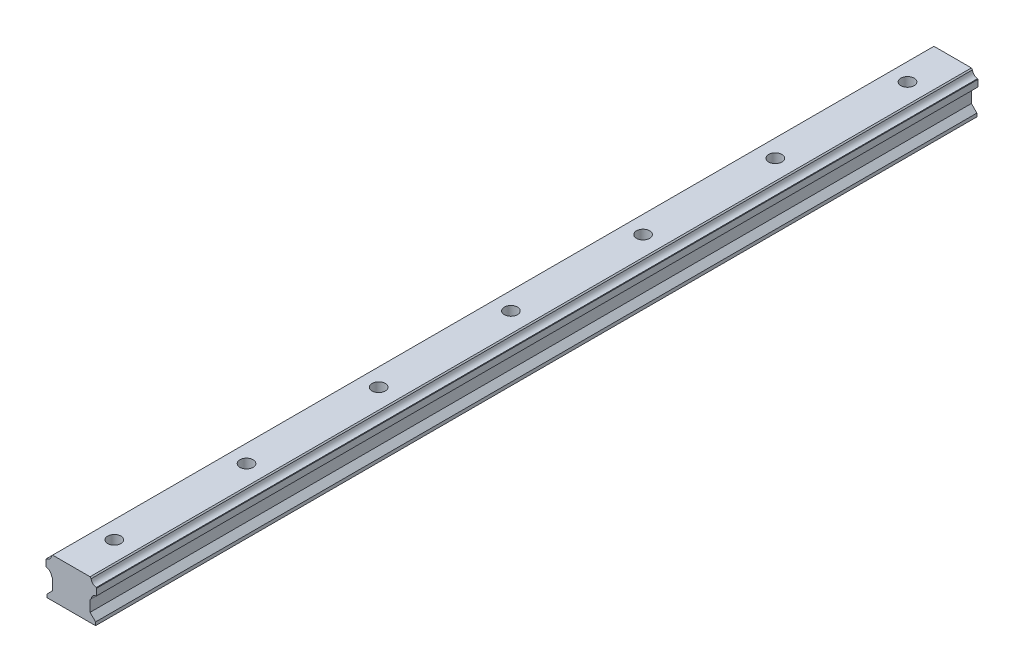
from build123d import *

# Parameters (mm, degrees)
ESTRUSIONE_ESTRUSIONE1_DEPTH      = 400
SCHIZZO2_R                        = 3
TAGLIO_ESTRUSIONE1_DEPTH          = 401.599824902
RIPETIZIONE_A_L1_COUNT            = 4
RIPETIZIONE_A_L1_PITCH            = 60
RIPETIZIONE_A_L2_COPY_1_SKETCH_R  = 3
RIPETIZIONE_A_L2_COPY_1_DEPTH     = 401.599824902
RIPETIZIONE_A_L2_COPY_2_SKETCH_R  = 3
RIPETIZIONE_A_L2_COPY_2_DEPTH     = 401.599824902
RIPETIZIONE_A_L2_COPY_3_SKETCH_R  = 3
RIPETIZIONE_A_L2_COPY_3_DEPTH     = 401.599824902
RIPETIZIONE_A_L2_COPY_4_SKETCH_R  = 3
RIPETIZIONE_A_L2_COPY_4_DEPTH     = 401.599824902
RIPETIZIONE_A_L2_COPY_5_SKETCH_R  = 3
RIPETIZIONE_A_L2_COPY_5_DEPTH     = 401.599824902
RIPETIZIONE_A_L2_COPY_6_SKETCH_R  = 3
RIPETIZIONE_A_L2_COPY_6_DEPTH     = 401.599824902
RIPETIZIONE_A_L2_COPY_7_SKETCH_R  = 3
RIPETIZIONE_A_L2_COPY_7_DEPTH     = 401.599824902
RIPETIZIONE_A_L2_COPY_8_SKETCH_R  = 3
RIPETIZIONE_A_L2_COPY_8_DEPTH     = 401.599824902
RIPETIZIONE_A_L2_COPY_9_SKETCH_R  = 3
RIPETIZIONE_A_L2_COPY_9_DEPTH     = 401.599824902
RIPETIZIONE_A_L2_COPY_10_SKETCH_R = 3
RIPETIZIONE_A_L2_COPY_10_DEPTH    = 401.599824902
RIPETIZIONE_A_L2_COPY_11_SKETCH_R = 3
RIPETIZIONE_A_L2_COPY_11_DEPTH    = 401.599824902
RIPETIZIONE_A_L2_COPY_12_SKETCH_R = 3
RIPETIZIONE_A_L2_COPY_12_DEPTH    = 401.599824902


with BuildPart() as part:
    # Schizzo1 → Estrusione-Estrusione1 (new body)
    with BuildSketch(Plane.XY):
        with BuildLine():
            Line((-10.001211602, -16.276222172), (-7.501211602, -13.776222172))
            Line((-7.501211602, -13.776222172), (-7.501211602, -8.776222172))
            Line((-7.501211602, -8.776222172), (-8.008796188, -8.268637585))
            ThreePointArc((-8.008796188, -8.268637585), (-8.733444649, -6.695460987), (-10.306621247, -5.970812526))
            Line((-10.306621247, -5.970812526), (-10.501211602, -5.776222172))
            Line((-10.501211602, -5.776222172), (-10.501211602, -2.776222172))
            Line((-10.501211602, -2.776222172), (-10.306621247, -2.581631817))
            ThreePointArc((-10.306621247, -2.581631817), (-8.733444649, -1.856983356), (-8.008796188, -0.283806758))
            Line((-8.008796188, -0.283806758), (-7.501211602, 0.223777828))
            Line((-7.501211602, 0.223777828), (9.498788398, 0.223777828))
            Line((9.498788398, 0.223777828), (10.006372984, -0.283806758))
            ThreePointArc((10.006372984, -0.283806758), (10.731021445, -1.856983356), (12.304198043, -2.581631817))
            Line((12.304198043, -2.581631817), (12.498788398, -2.776222172))
            Line((12.498788398, -2.776222172), (12.498788398, -5.776222172))
            Line((12.498788398, -5.776222172), (12.304198043, -5.970812526))
            ThreePointArc((12.304198043, -5.970812526), (10.731021445, -6.695460987), (10.006372984, -8.268637585))
            Line((10.006372984, -8.268637585), (9.498788398, -8.776222172))
            Line((9.498788398, -8.776222172), (9.498788398, -13.776222172))
            Line((9.498788398, -13.776222172), (11.998788398, -16.276222172))
            Line((11.998788398, -16.276222172), (11.998788398, -17.776222172))
            Line((11.998788398, -17.776222172), (-10.001211602, -17.776222172))
            Line((-10.001211602, -17.776222172), (-10.001211602, -16.276222172))
        make_face()
    extrude(amount=ESTRUSIONE_ESTRUSIONE1_DEPTH)

    # Schizzo2 → Taglio-Estrusione1 (cut, through all)
    with BuildSketch(Plane(origin=(0, 0.223777828, 0), x_dir=(1, 0, 0), z_dir=(0, 1, 0))):
        with Locations(Location((0.499394199, -200, 0), (0, 0, 270))):
            Circle(SCHIZZO2_R)
    taglio_estrusione1 = extrude(amount=-TAGLIO_ESTRUSIONE1_DEPTH, mode=Mode.SUBTRACT)

    # Ripetizione a L1: Taglio-Estrusione1 ×4
    with Locations(*[(0, 0, i * RIPETIZIONE_A_L1_PITCH) for i in range(1, RIPETIZIONE_A_L1_COUNT)]):
        add(taglio_estrusione1, mode=Mode.SUBTRACT)

    # Ripetizione a L2 copy 1 sketch → Ripetizione a L2 copy 1 (cut, through all)
    with BuildSketch(Plane(origin=(0, 0.223777828, 0), x_dir=(1, 0, 0), z_dir=(0, 1, 0))):
        with Locations(Location((0.499394199, -200, 0), (0, 0, 270))):
            Circle(RIPETIZIONE_A_L2_COPY_1_SKETCH_R)
    extrude(amount=-RIPETIZIONE_A_L2_COPY_1_DEPTH, mode=Mode.SUBTRACT)

    # Ripetizione a L2 copy 2 sketch → Ripetizione a L2 copy 2 (cut, through all)
    with BuildSketch(Plane(origin=(0, 0.223777828, -60), x_dir=(1, 0, 0), z_dir=(0, 1, 0))):
        with Locations(Location((0.499394199, -200, 0), (0, 0, 270))):
            Circle(RIPETIZIONE_A_L2_COPY_2_SKETCH_R)
    extrude(amount=-RIPETIZIONE_A_L2_COPY_2_DEPTH, mode=Mode.SUBTRACT)

    # Ripetizione a L2 copy 3 sketch → Ripetizione a L2 copy 3 (cut, through all)
    with BuildSketch(Plane(origin=(0, 0.223777828, -120), x_dir=(1, 0, 0), z_dir=(0, 1, 0))):
        with Locations(Location((0.499394199, -200, 0), (0, 0, 270))):
            Circle(RIPETIZIONE_A_L2_COPY_3_SKETCH_R)
    extrude(amount=-RIPETIZIONE_A_L2_COPY_3_DEPTH, mode=Mode.SUBTRACT)

    # Ripetizione a L2 copy 4 sketch → Ripetizione a L2 copy 4 (cut, through all)
    with BuildSketch(Plane(origin=(0, 0.223777828, 60), x_dir=(1, 0, 0), z_dir=(0, 1, 0))):
        with Locations(Location((0.499394199, -200, 0), (0, 0, 270))):
            Circle(RIPETIZIONE_A_L2_COPY_4_SKETCH_R)
    extrude(amount=-RIPETIZIONE_A_L2_COPY_4_DEPTH, mode=Mode.SUBTRACT)

    # Ripetizione a L2 copy 5 sketch → Ripetizione a L2 copy 5 (cut, through all)
    with BuildSketch(Plane(origin=(0, 0.223777828, 0), x_dir=(1, 0, 0), z_dir=(0, 1, 0))):
        with Locations(Location((0.499394199, -200, 0), (0, 0, 270))):
            Circle(RIPETIZIONE_A_L2_COPY_5_SKETCH_R)
    extrude(amount=-RIPETIZIONE_A_L2_COPY_5_DEPTH, mode=Mode.SUBTRACT)

    # Ripetizione a L2 copy 6 sketch → Ripetizione a L2 copy 6 (cut, through all)
    with BuildSketch(Plane(origin=(0, 0.223777828, -60), x_dir=(1, 0, 0), z_dir=(0, 1, 0))):
        with Locations(Location((0.499394199, -200, 0), (0, 0, 270))):
            Circle(RIPETIZIONE_A_L2_COPY_6_SKETCH_R)
    extrude(amount=-RIPETIZIONE_A_L2_COPY_6_DEPTH, mode=Mode.SUBTRACT)

    # Ripetizione a L2 copy 7 sketch → Ripetizione a L2 copy 7 (cut, through all)
    with BuildSketch(Plane(origin=(0, 0.223777828, 120), x_dir=(1, 0, 0), z_dir=(0, 1, 0))):
        with Locations(Location((0.499394199, -200, 0), (0, 0, 270))):
            Circle(RIPETIZIONE_A_L2_COPY_7_SKETCH_R)
    extrude(amount=-RIPETIZIONE_A_L2_COPY_7_DEPTH, mode=Mode.SUBTRACT)

    # Ripetizione a L2 copy 8 sketch → Ripetizione a L2 copy 8 (cut, through all)
    with BuildSketch(Plane(origin=(0, 0.223777828, 60), x_dir=(1, 0, 0), z_dir=(0, 1, 0))):
        with Locations(Location((0.499394199, -200, 0), (0, 0, 270))):
            Circle(RIPETIZIONE_A_L2_COPY_8_SKETCH_R)
    extrude(amount=-RIPETIZIONE_A_L2_COPY_8_DEPTH, mode=Mode.SUBTRACT)

    # Ripetizione a L2 copy 9 sketch → Ripetizione a L2 copy 9 (cut, through all)
    with BuildSketch(Plane(origin=(0, 0.223777828, 0), x_dir=(1, 0, 0), z_dir=(0, 1, 0))):
        with Locations(Location((0.499394199, -200, 0), (0, 0, 270))):
            Circle(RIPETIZIONE_A_L2_COPY_9_SKETCH_R)
    extrude(amount=-RIPETIZIONE_A_L2_COPY_9_DEPTH, mode=Mode.SUBTRACT)

    # Ripetizione a L2 copy 10 sketch → Ripetizione a L2 copy 10 (cut, through all)
    with BuildSketch(Plane(origin=(0, 0.223777828, -60), x_dir=(1, 0, 0), z_dir=(0, 1, 0))):
        with Locations(Location((0.499394199, -200, 0), (0, 0, 270))):
            Circle(RIPETIZIONE_A_L2_COPY_10_SKETCH_R)
    extrude(amount=-RIPETIZIONE_A_L2_COPY_10_DEPTH, mode=Mode.SUBTRACT)

    # Ripetizione a L2 copy 11 sketch → Ripetizione a L2 copy 11 (cut, through all)
    with BuildSketch(Plane(origin=(0, 0.223777828, -120), x_dir=(1, 0, 0), z_dir=(0, 1, 0))):
        with Locations(Location((0.499394199, -200, 0), (0, 0, 270))):
            Circle(RIPETIZIONE_A_L2_COPY_11_SKETCH_R)
    extrude(amount=-RIPETIZIONE_A_L2_COPY_11_DEPTH, mode=Mode.SUBTRACT)

    # Ripetizione a L2 copy 12 sketch → Ripetizione a L2 copy 12 (cut, through all)
    with BuildSketch(Plane(origin=(0, 0.223777828, -180), x_dir=(1, 0, 0), z_dir=(0, 1, 0))):
        with Locations(Location((0.499394199, -200, 0), (0, 0, 270))):
            Circle(RIPETIZIONE_A_L2_COPY_12_SKETCH_R)
    extrude(amount=-RIPETIZIONE_A_L2_COPY_12_DEPTH, mode=Mode.SUBTRACT)


solid = part.part
